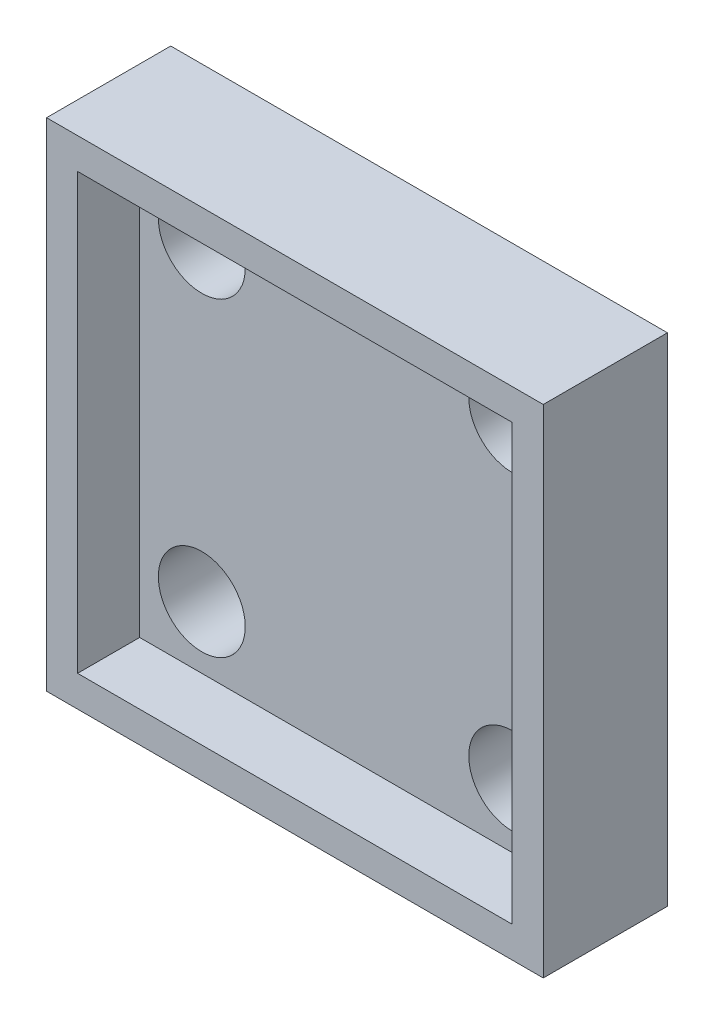
from build123d import *

# Parameters (mm, degrees)
CROQUIS4_W              = 40
CROQUIS4_H              = 40
SALIENTE_EXTRUIR7_DEPTH = 5
CROQUIS5_W              = 40
CROQUIS5_H              = 40
CROQUIS5_W_2            = 35.003943974
CROQUIS5_H_2            = 35.003943974
SALIENTE_EXTRUIR8_DEPTH = 5
CROQUIS6_R              = 3.5
CORTAR_EXTRUIR1_DEPTH   = 13


with BuildPart() as part:
    # Croquis4 → Saliente-Extruir7 (new body)
    with BuildSketch(Plane.XY):
        Rectangle(CROQUIS4_W, CROQUIS4_H)
    extrude(amount=SALIENTE_EXTRUIR7_DEPTH)

    # Croquis5 → Saliente-Extruir8 (add)
    with BuildSketch(Plane.XY.offset(5)):
        Rectangle(CROQUIS5_W, CROQUIS5_H)
        Rectangle(CROQUIS5_W_2, CROQUIS5_H_2, mode=Mode.SUBTRACT)
    extrude(amount=SALIENTE_EXTRUIR8_DEPTH)

    # Croquis6 → Cortar-Extruir1 (cut)
    with BuildSketch(Plane.XY.offset(5)):
        with Locations((-12.5, 12.5)):
            Circle(CROQUIS6_R)
        with Locations((12.5, 12.5)):
            Circle(CROQUIS6_R)
        with Locations((-12.5, -12.5)):
            Circle(CROQUIS6_R)
        with Locations((12.5, -12.5)):
            Circle(CROQUIS6_R)
    extrude(amount=-CORTAR_EXTRUIR1_DEPTH, mode=Mode.SUBTRACT)


solid = part.part
